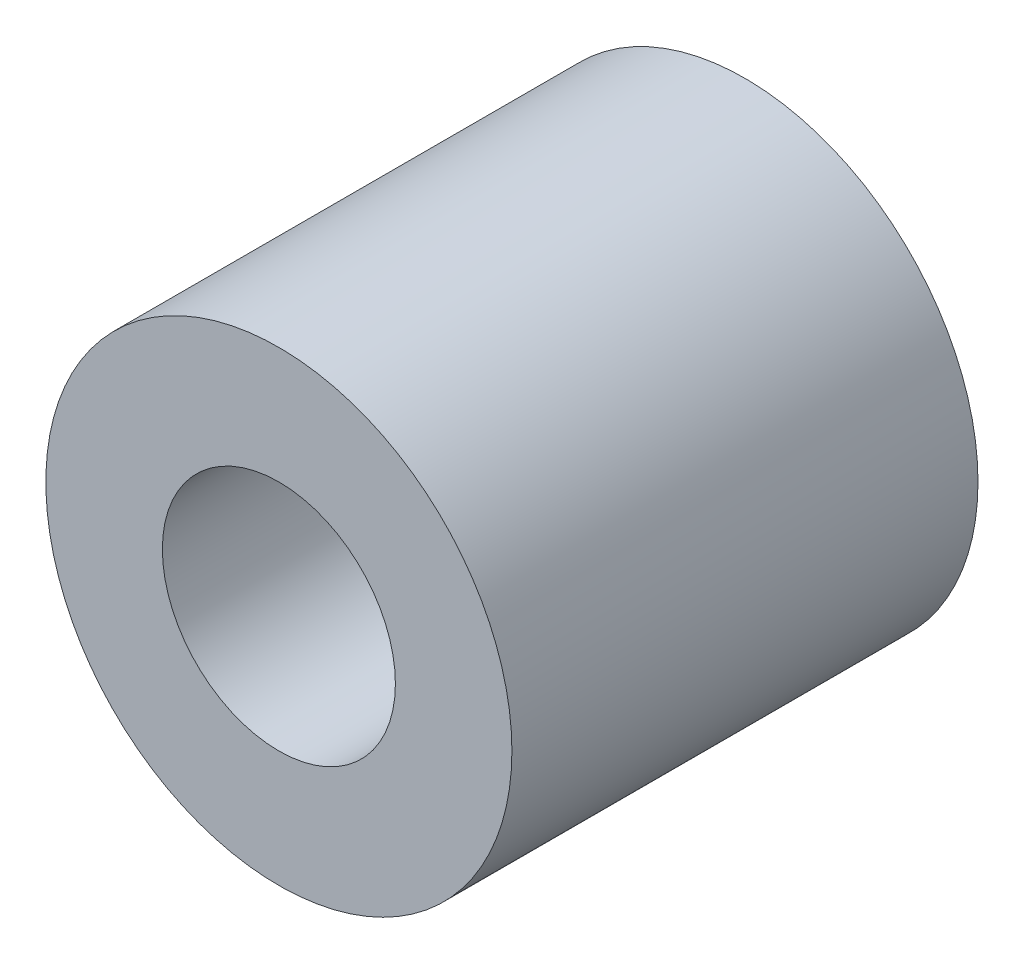
from build123d import *

# Parameters (mm, degrees)
SCHIZZO1_R                   = 5
SCHIZZO1_R_2                 = 2.5
ESTRUSIONE_ESTRUSIONE1_DEPTH = 10


with BuildPart() as part:
    # Schizzo1 → Estrusione-Estrusione1 (new body)
    with BuildSketch(Plane.XY):
        Circle(SCHIZZO1_R)
        Circle(SCHIZZO1_R_2, mode=Mode.SUBTRACT)
    extrude(amount=-ESTRUSIONE_ESTRUSIONE1_DEPTH)


solid = part.part
